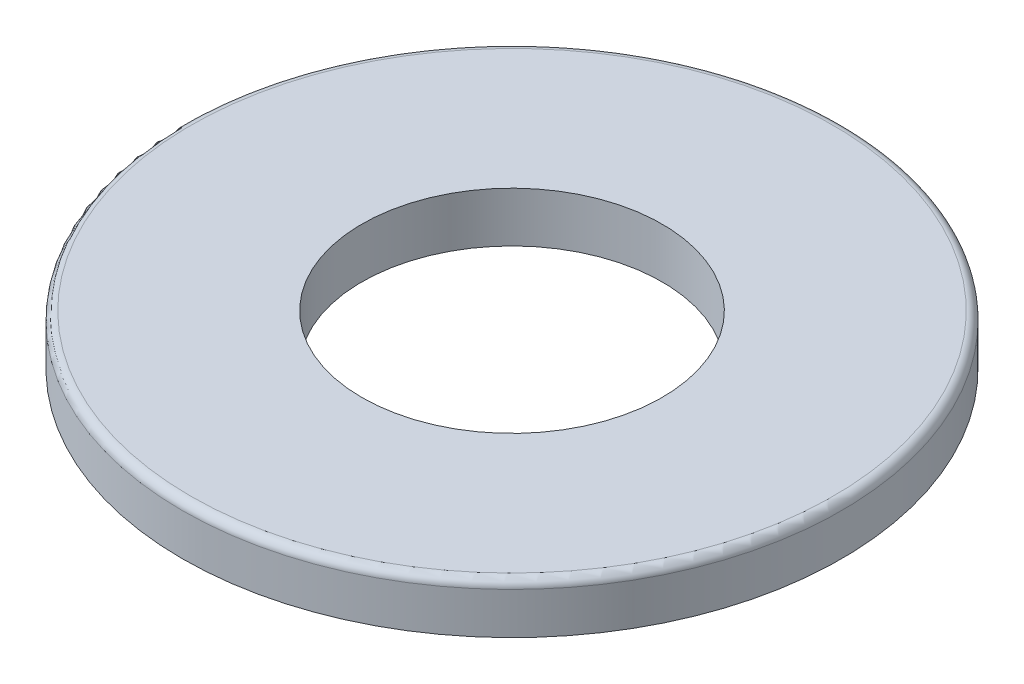
from build123d import *

# Parameters (mm, degrees)
SKETCH1_R           = 7.9
BOSS_EXTRUDE1_DEPTH = 1.2
SKETCH2_R           = 3.6
CUT_EXTRUDE1_DEPTH  = 1.2
FILLET1_R           = 0.2


with BuildPart() as part:
    # Sketch1 → Boss-Extrude1 (new body)
    with BuildSketch(Plane(origin=(0, 0, 0), x_dir=(1, 0, 0), z_dir=(0, 1, 0))):
        with Locations(Location((0, 0, 0), (0, 0, 270))):
            Circle(SKETCH1_R)
    extrude(amount=BOSS_EXTRUDE1_DEPTH)

    # Sketch2 → Cut-Extrude1 (cut)
    with BuildSketch(Plane(origin=(0, 1.2, 0), x_dir=(1, 0, 0), z_dir=(0, 1, 0))):
        with Locations(Location((0, 0, 0), (0, 0, 270))):
            Circle(SKETCH2_R)
    extrude(amount=-CUT_EXTRUDE1_DEPTH, mode=Mode.SUBTRACT)

    # Fillet1
    fillet1_edges = [part.edges().sort_by_distance(p)[0] for p in [
        (0, 1.2, -7.9),
    ]]
    fillet(fillet1_edges, radius=FILLET1_R)


solid = part.part
